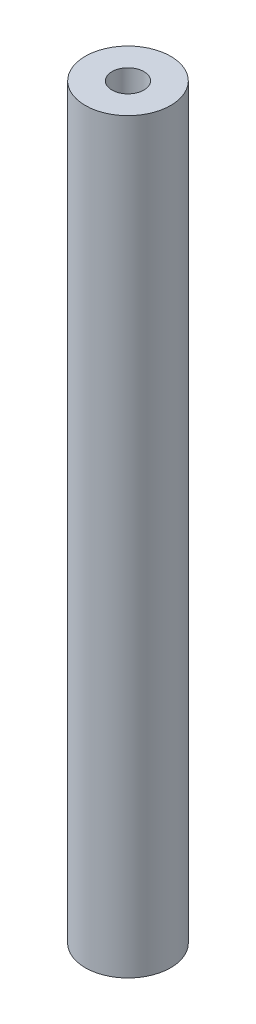
from build123d import *

# Parameters (mm, degrees)
SKETCH_1_R      = 2
SKETCH_1_R_2    = 0.75
EXTRUDE_1_DEPTH = 35


with BuildPart() as part:
    # 草图1 → 凸台-拉伸1 (new body)
    with BuildSketch(Plane(origin=(0, 0, 0), x_dir=(1, 0, 0), z_dir=(0, 1, 0))):
        with Locations(Location((-1.932069985, 1.410717767, 0), (0, 0, 270))):
            Circle(SKETCH_1_R)
        with Locations(Location((-1.932069985, 1.410717767, 0), (0, 0, 270))):
            Circle(SKETCH_1_R_2, mode=Mode.SUBTRACT)
    extrude(amount=EXTRUDE_1_DEPTH)


solid = part.part
